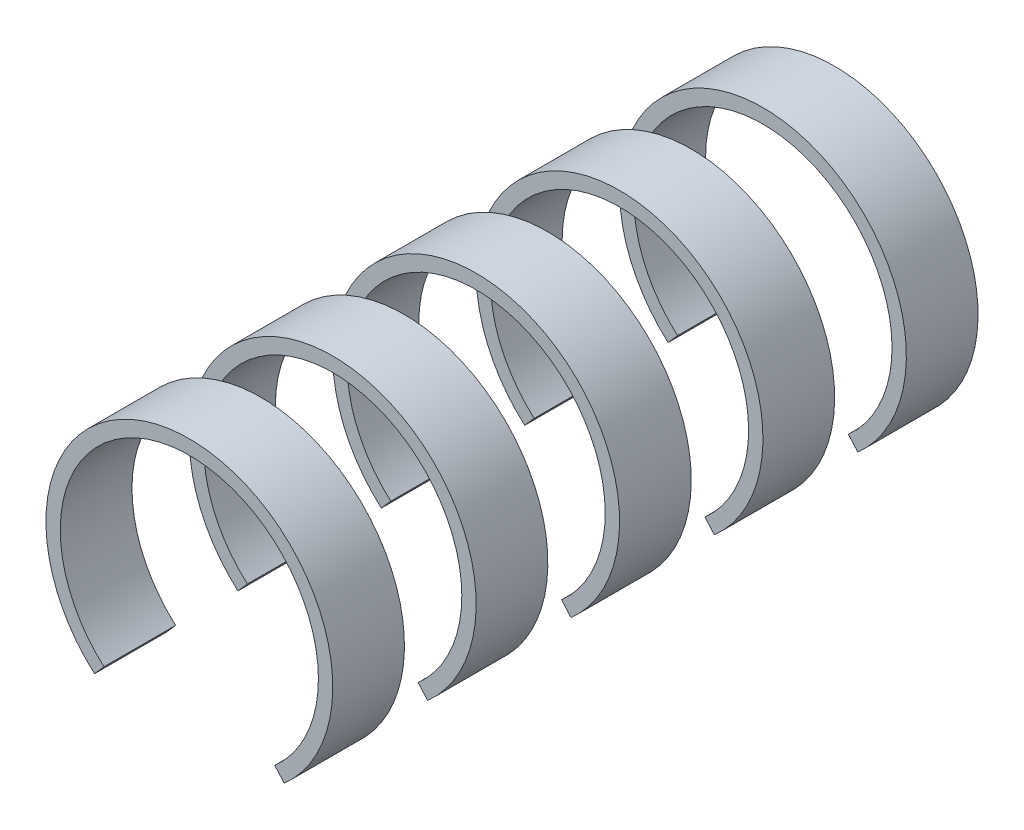
from build123d import *

# Parameters (mm, degrees)
EXTRUDE_THIN1_START = -350
EXTRUDE_THIN1_DEPTH = 50
LPATTERN1_COUNT     = 5
LPATTERN1_PITCH     = 100


with BuildPart() as part:
    # Sketch2 → Extrude-Thin1 (new body)
    with BuildSketch(Plane.XY.offset(EXTRUDE_THIN1_START)):
        with BuildLine():
            ThreePointArc((-66.143782777, 3), (0, 178), (66.143782777, 3))
            Line((66.143782777, 3), (59.529404499, 10.5))
            ThreePointArc((59.529404499, 10.5), (0, 168), (-59.529404499, 10.5))
            Line((-59.529404499, 10.5), (-66.143782777, 3))
        make_face()
    extrude(amount=-EXTRUDE_THIN1_DEPTH)


with BuildPart() as lpattern1_1:
    # LPattern1: pattern copy
    add(part.part.moved(Location(Vector(0, 0, -1) * (1 * LPATTERN1_PITCH))))


with BuildPart() as lpattern1_2:
    # LPattern1: pattern copy
    add(part.part.moved(Location(Vector(0, 0, -1) * (2 * LPATTERN1_PITCH))))


with BuildPart() as lpattern1_3:
    # LPattern1: pattern copy
    add(part.part.moved(Location(Vector(0, 0, -1) * (3 * LPATTERN1_PITCH))))


with BuildPart() as lpattern1_4:
    # LPattern1: pattern copy
    add(part.part.moved(Location(Vector(0, 0, -1) * (4 * LPATTERN1_PITCH))))


solid = Compound([part.part, lpattern1_1.part, lpattern1_2.part, lpattern1_3.part, lpattern1_4.part])
